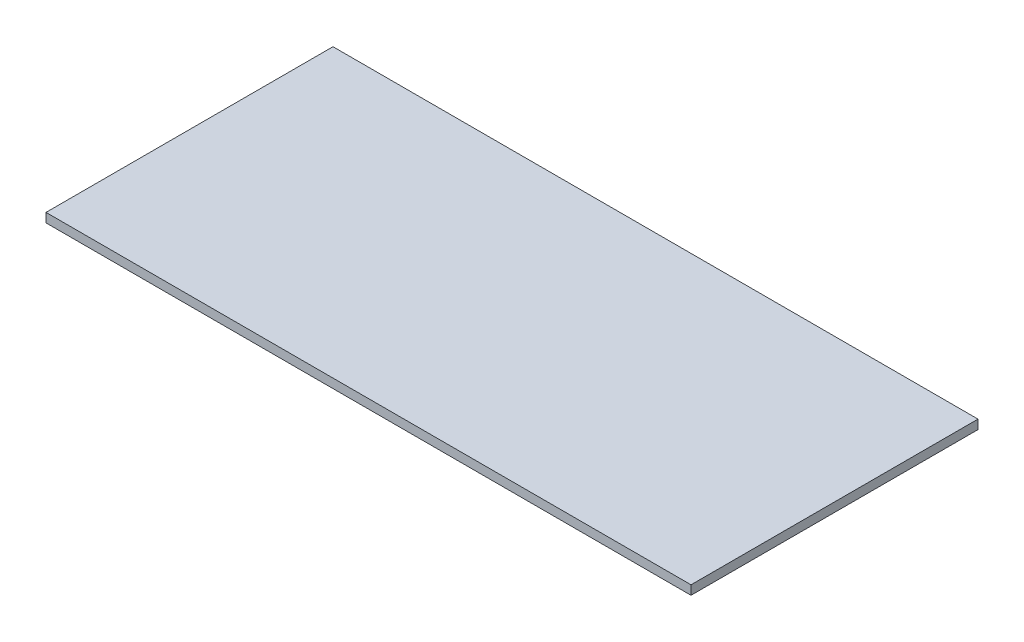
from build123d import *

# Parameters (mm, degrees)
SKETCH1_W           = 400.05
SKETCH1_H           = 12.7
BOSS_EXTRUDE1_DEPTH = 449.58


with BuildPart() as part:
    # Sketch1 → Boss-Extrude1 (new, symmetric)
    with BuildSketch(Plane(origin=(0, 0, 0), x_dir=(0, 0, -1), z_dir=(1, 0, 0))):
        Rectangle(SKETCH1_W, SKETCH1_H)
    extrude(amount=BOSS_EXTRUDE1_DEPTH, both=True)


solid = part.part
